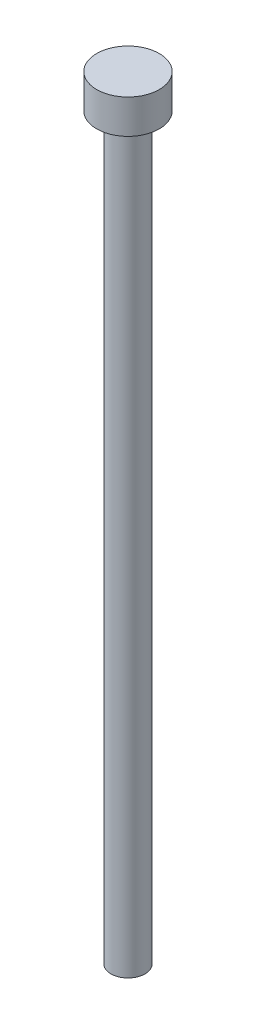
from build123d import *

# Parameters (mm, degrees)
SKETCH1_R           = 3
BOSS_EXTRUDE1_DEPTH = 130
SKETCH2_R           = 5.5
BOSS_EXTRUDE2_DEPTH = 6


with BuildPart() as part:
    # Sketch1 → Boss-Extrude1 (new body)
    with BuildSketch(Plane(origin=(0, 0, 0), x_dir=(1, 0, 0), z_dir=(0, 1, 0))):
        with Locations(Location((0, 0, 0), (0, 0, 270))):
            Circle(SKETCH1_R)
    extrude(amount=-BOSS_EXTRUDE1_DEPTH)

    # Sketch2 → Boss-Extrude2 (add)
    with BuildSketch(Plane(origin=(0, 0, 0), x_dir=(1, 0, 0), z_dir=(0, 1, 0))):
        with Locations(Location((0, 0, 0), (0, 0, 270))):
            Circle(SKETCH2_R)
    extrude(amount=BOSS_EXTRUDE2_DEPTH)


solid = part.part
